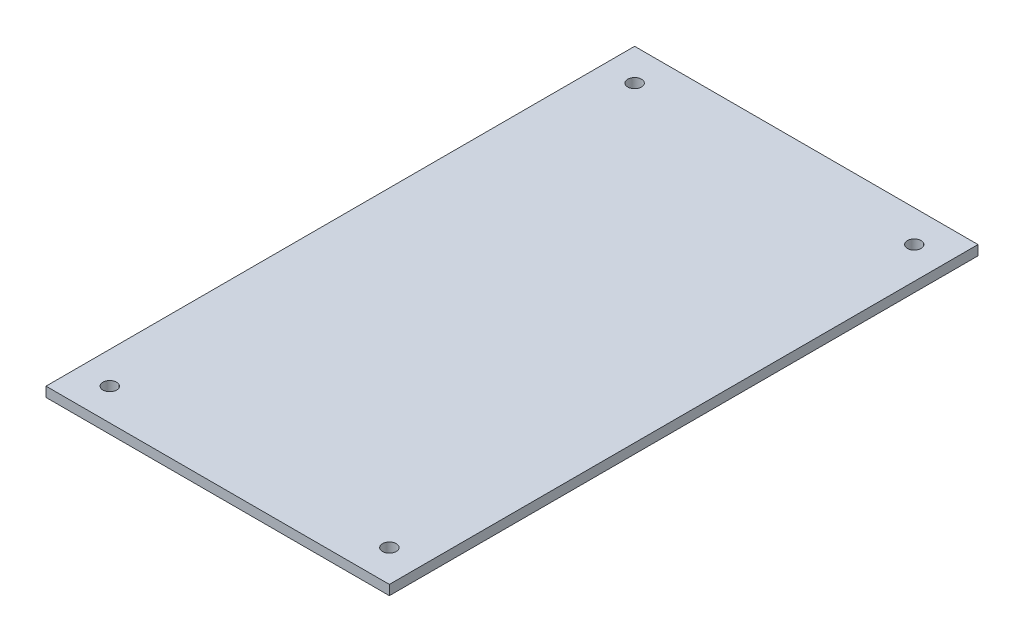
from build123d import *

# Parameters (mm, degrees)
SKETCH_1_W          = 64
SKETCH_1_H          = 114
EXTRUDE_1_DEPTH     = 2
SKETCH_2_W          = 70
SKETCH_2_H          = 120
EXTRUDE_4_DEPTH     = 2
SKETCH_4_R          = 1.4
CUT_EXTRUDE_1_DEPTH = 70.577295147


with BuildPart() as part:
    # Эскиз1 → Бобышка-Вытянуть1 (new body)
    with BuildSketch(Plane(origin=(0, 0, 0), x_dir=(1, 0, 0), z_dir=(0, 1, 0))):
        Rectangle(SKETCH_1_W, SKETCH_1_H)
    extrude(amount=EXTRUDE_1_DEPTH)

    # Эскиз2 → Бобышка-Вытянуть4 (add)
    with BuildSketch(Plane(origin=(0, 2, 0), x_dir=(1, 0, 0), z_dir=(0, 1, 0))):
        Rectangle(SKETCH_2_W, SKETCH_2_H)
    extrude(amount=EXTRUDE_4_DEPTH)

    # Эскиз4 → Вырез-Вытянуть1 (cut, through all)
    with BuildSketch(Plane(origin=(0, 4, 0), x_dir=(1, 0, 0), z_dir=(0, 1, 0))):
        with Locations(Location((-28.5, 53.5, 0), (0, 0, 270))):
            Circle(SKETCH_4_R)
        with Locations(Location((28.5, 53.5, 0), (0, 0, 270))):
            Circle(SKETCH_4_R)
        with Locations(Location((-28.5, -53.5, 0), (0, 0, 270))):
            Circle(SKETCH_4_R)
        with Locations(Location((28.5, -53.5, 0), (0, 0, 270))):
            Circle(SKETCH_4_R)
    extrude(amount=-CUT_EXTRUDE_1_DEPTH, mode=Mode.SUBTRACT)


solid = part.part
